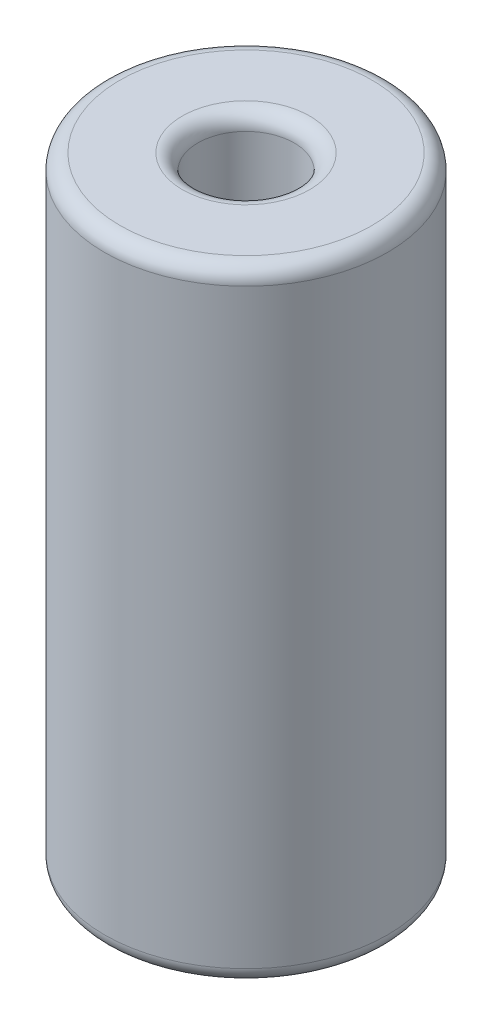
from build123d import *

# Parameters (mm, degrees)
SKETCH1_R           = 4.55
SKETCH1_R_2         = 1.55
BOSS_EXTRUDE1_DEPTH = 20
FILLET1_R           = 0.5


with BuildPart() as part:
    # Sketch1 → Boss-Extrude1 (new body)
    with BuildSketch(Plane(origin=(0, 0, 0), x_dir=(1, 0, 0), z_dir=(0, 1, 0))):
        with Locations(Location((0, 0, 0), (0, 0, 270))):
            Circle(SKETCH1_R)
        with Locations(Location((0, 0, 0), (0, 0, 270))):
            Circle(SKETCH1_R_2, mode=Mode.SUBTRACT)
    extrude(amount=BOSS_EXTRUDE1_DEPTH)

    # Fillet1
    fillet1_edges = [part.edges().sort_by_distance(p)[0] for p in [
        (0, 0, -4.55),
        (0, 20, -4.55),
        (0, 0, -1.55),
        (0, 20, -1.55),
    ]]
    fillet(fillet1_edges, radius=FILLET1_R)


solid = part.part
